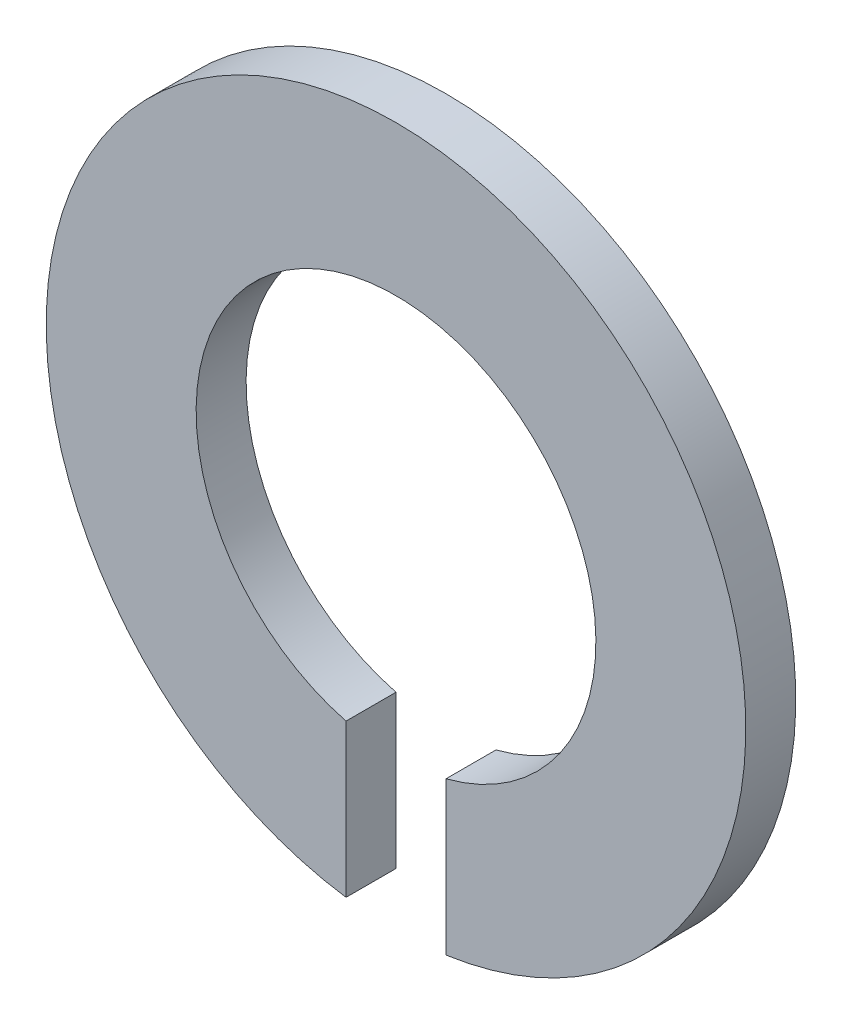
from build123d import *

# Parameters (mm, degrees)
BOSS_EXTRU_2_DEPTH = 0.5


with BuildPart() as part:
    # Esquisse2 → Boss.-Extru.2 (new body)
    with BuildSketch(Plane.XY):
        with BuildLine():
            Line((-0.5, -3.464101615), (-0.5, -1.936491673))
            ThreePointArc((-0.5, -1.936491673), (0, 2), (0.5, -1.936491673))
            Line((0.5, -1.936491673), (0.5, -3.464101615))
            ThreePointArc((0.5, -3.464101615), (0, 3.5), (-0.5, -3.464101615))
        make_face()
    extrude(amount=BOSS_EXTRU_2_DEPTH)


solid = part.part
